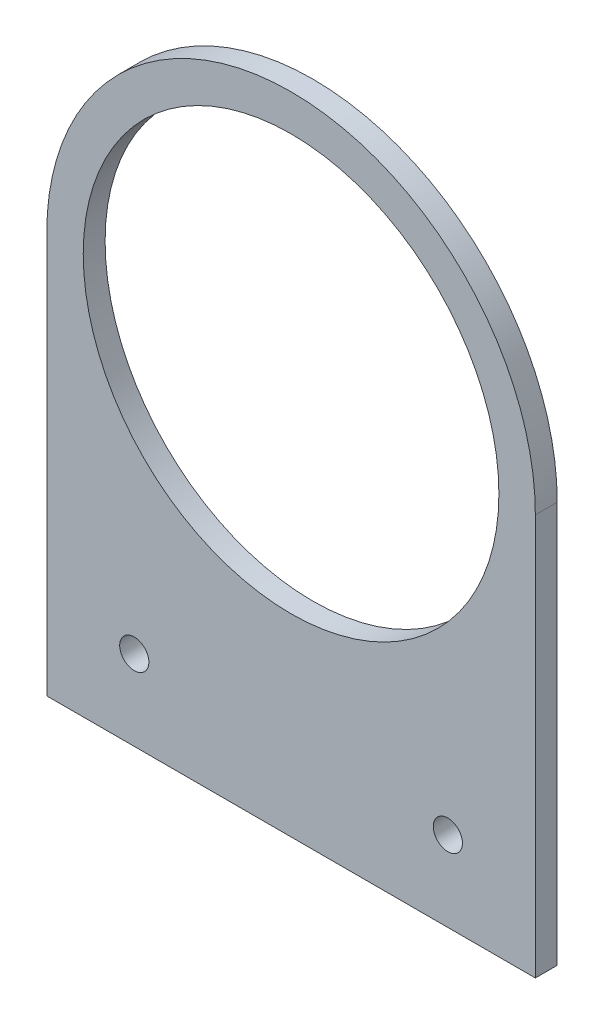
from build123d import *

# Parameters (mm, degrees)
SKETCH1_R           = 28.5
SKETCH1_R_2         = 2
BOSS_EXTRUDE1_DEPTH = 3


with BuildPart() as part:
    # Sketch1 → Boss-Extrude1 (new body)
    with BuildSketch(Plane.XY):
        with BuildLine():
            Line((-33.5, 0), (33.5, 0))
            Line((33.5, 0), (33.5, 55))
            ThreePointArc((33.5, 55), (0, 88.5), (-33.5, 55))
            Line((-33.5, 55), (-33.5, 0))
        make_face()
        with Locations((0, 55)):
            Circle(SKETCH1_R, mode=Mode.SUBTRACT)
        with Locations((-21.5, 11)):
            Circle(SKETCH1_R_2, mode=Mode.SUBTRACT)
        with Locations((21.5, 11)):
            Circle(SKETCH1_R_2, mode=Mode.SUBTRACT)
    extrude(amount=BOSS_EXTRUDE1_DEPTH)


solid = part.part
